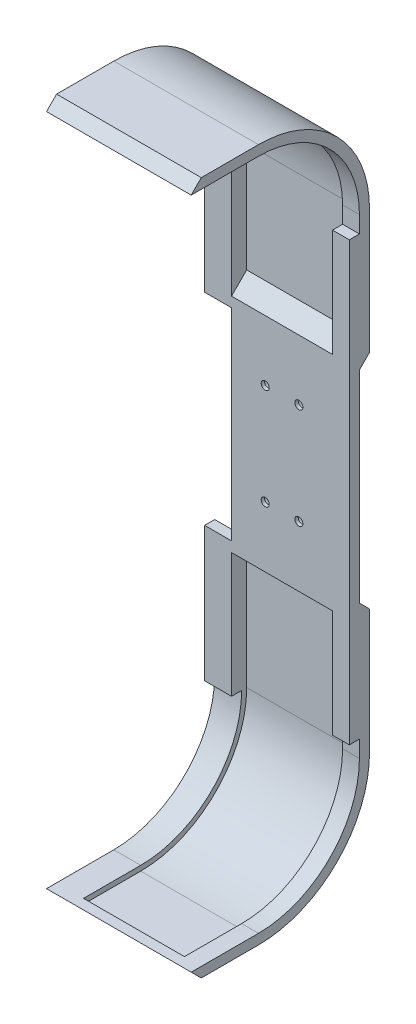
from build123d import *

# Parameters (mm, degrees)
EXTRUDE_1_DEPTH          = 3
EXTRUDE_2_DEPTH          = 287
SKETCH_4_W               = 21.736589458
SKETCH_4_H               = 200
CUT_EXTRUDE_1_DEPTH      = 43
SKETCH_5_W               = 23.415155123
SKETCH_5_H               = 200
CUT_EXTRUDE_2_DEPTH      = 43
CUT_EXTRUDE_6_DEPTH      = 100
CUT_EXTRUDE_6_DEPTH_BACK = 100
SKETCH_6_W               = 303.843563536
SKETCH_6_H               = 206
HOLE_WIZARD_1_AT_2_COUNT = 2
HOLE_WIZARD_1_AT_2_PITCH = 10
HOLE_WIZARD_1_AT_3_COUNT = 2
HOLE_WIZARD_1_AT_3_PITCH = 31.622776602
HOLE_WIZARD_1_AT_4_COUNT = 2
HOLE_WIZARD_1_AT_4_PITCH = 30
CUT_EXTRUDE_7_DEPTH      = 30


with BuildPart() as part:
    # 草图1 → 凸台-拉伸1 (new body)
    with BuildSketch(Plane.XY):
        Polygon((-143.75, 30), (-143.75, 70), (-105.75, 70), (-105.75, 65), (-100.25, 65), (-100.25, 70), (99.75, 70), (99.75, 65), (105.25, 65), (105.25, 70), (143.25, 70), (143.25, 30), (135.25, 30), (135.25, -30), (143.25, -30), (143.25, -70), (105.25, -70), (105.25, -65), (99.75, -65), (99.75, -70), (-100.25, -70), (-100.25, -65), (-105.75, -65), (-105.75, -70), (-143.75, -70), (-143.75, -30), (-135.75, -30), (-135.75, 30), align=None)
    extrude(amount=EXTRUDE_1_DEPTH)

    # 草图2 → 凸台-拉伸2 (add)
    with BuildSketch(Plane.ZY.offset(143.75)):
        with BuildLine():
            Line((0, 70), (0, 30))
            Line((0, 30), (-3, 33))
            Line((-3, 33), (-3, 70))
            ThreePointArc((-3, 70), (6.665476221, 93.334523779), (30, 103))
            Line((30, 103), (47, 103))
            Line((47, 103), (50, 100))
            Line((50, 100), (45, 90))
            Line((45, 90), (60, 90))
            Line((60, 90), (60, 87))
            Line((60, 87), (41, 87))
            Line((41, 87), (47, 100))
            Line((47, 100), (30, 100))
            ThreePointArc((30, 100), (8.786796564, 91.213203436), (0, 70))
        make_face()
        with BuildLine():
            Line((30, -100), (47, -100))
            Line((47, -100), (41, -87))
            Line((41, -87), (60, -87))
            Line((60, -87), (60, -90))
            Line((60, -90), (45, -90))
            Line((45, -90), (50, -100))
            Line((50, -100), (47, -103))
            Line((47, -103), (30, -103))
            ThreePointArc((30, -103), (6.665476221, -93.334523779), (-3, -70))
            Line((-3, -70), (-3, -33))
            Line((-3, -33), (0, -30))
            Line((0, -30), (0, -70))
            ThreePointArc((0, -70), (8.786796564, -91.213203436), (30, -100))
        make_face()
    extrude(amount=-EXTRUDE_2_DEPTH)

    # 草图4 → 切除-拉伸1 (cut)
    with BuildSketch(Plane.ZY.offset(143.75)):
        with Locations((49.368294729, 0)):
            Rectangle(SKETCH_4_W, SKETCH_4_H)
    extrude(amount=-CUT_EXTRUDE_1_DEPTH, mode=Mode.SUBTRACT)

    # 草图5 → 切除-拉伸2 (cut)
    with BuildSketch(Plane(origin=(143.25, 0, 0), x_dir=(0, 0, -1), z_dir=(1, 0, 0))):
        with Locations((-51.459603014, 0)):
            Rectangle(SKETCH_5_W, SKETCH_5_H)
    extrude(amount=-CUT_EXTRUDE_2_DEPTH, mode=Mode.SUBTRACT)

    # 草图6 → 切除-拉伸6 (cut, two sides: drawn at the far end of the back side and taken through both)
    with BuildSketch(Plane.XY.offset(-CUT_EXTRUDE_6_DEPTH_BACK)):
        with Locations((51.171781768, 0)):
            Rectangle(SKETCH_6_W, SKETCH_6_H)
    extrude(amount=CUT_EXTRUDE_6_DEPTH + CUT_EXTRUDE_6_DEPTH_BACK, mode=Mode.SUBTRACT)

    # 草图8 → 大小六角凹头盖螺钉柱孔1 (revolve, cut)
    with BuildSketch(Plane(origin=(-115.75, 15, 0), x_dir=(0, 1, 0), z_dir=(1, 0, 0))):
        Polygon((0, 0), (0, 50), (1.2, 50), (1.2, 2), (2.15, 2), (2.15, 0.024142219), (2.175, 0), align=None)
    hole_wizard_1 = revolve(axis=Axis((-115.75, 15, -6.35), (0, 0, 1)), mode=Mode.SUBTRACT)

    # 大小六角凹头盖螺钉柱孔1 at 2: 大小六角凹头盖螺钉柱孔1 ×2
    with Locations(*[(-i * HOLE_WIZARD_1_AT_2_PITCH, 0, 0) for i in range(1, HOLE_WIZARD_1_AT_2_COUNT)]):
        add(hole_wizard_1, mode=Mode.SUBTRACT)

    # 大小六角凹头盖螺钉柱孔1 at 3: 大小六角凹头盖螺钉柱孔1 ×2
    with Locations(*[Vector(-0.3162277660168408, -0.9486832980505129, 0) * (i * HOLE_WIZARD_1_AT_3_PITCH) for i in range(1, HOLE_WIZARD_1_AT_3_COUNT)]):
        add(hole_wizard_1, mode=Mode.SUBTRACT)

    # 大小六角凹头盖螺钉柱孔1 at 4: 大小六角凹头盖螺钉柱孔1 ×2
    with Locations(*[(0, -i * HOLE_WIZARD_1_AT_4_PITCH, 0) for i in range(1, HOLE_WIZARD_1_AT_4_COUNT)]):
        add(hole_wizard_1, mode=Mode.SUBTRACT)

    # 草图10 → 切除-拉伸7 (cut)
    with BuildSketch(Plane.ZY.offset(135.75)):
        with BuildLine():
            Line((30, 100), (47, 100))
            Line((47, 100), (45.5, 101.5))
            Line((45.5, 101.5), (30, 101.5))
            ThreePointArc((30, 101.5), (7.726136393, 92.273863607), (-1.5, 70))
            Line((-1.5, 70), (-1.5, 37.5))
            Line((-1.5, 37.5), (3, 33))
            Line((3, 33), (3, 70))
            Line((3, 70), (0, 70))
            ThreePointArc((0, 70), (8.786796564, 91.213203436), (30, 100))
        make_face()
        with BuildLine():
            Line((-1.5, -37.5), (-1.5, -70))
            ThreePointArc((-1.5, -70), (7.726136393, -92.273863607), (30, -101.5))
            Line((30, -101.5), (45.5, -101.5))
            Line((45.5, -101.5), (47, -100))
            Line((47, -100), (30, -100))
            ThreePointArc((30, -100), (8.786796564, -91.213203436), (0, -70))
            Line((0, -70), (3, -70))
            Line((3, -70), (3, -33))
            Line((3, -33), (-1.5, -37.5))
        make_face()
    extrude(amount=-CUT_EXTRUDE_7_DEPTH, mode=Mode.SUBTRACT)


solid = part.part
